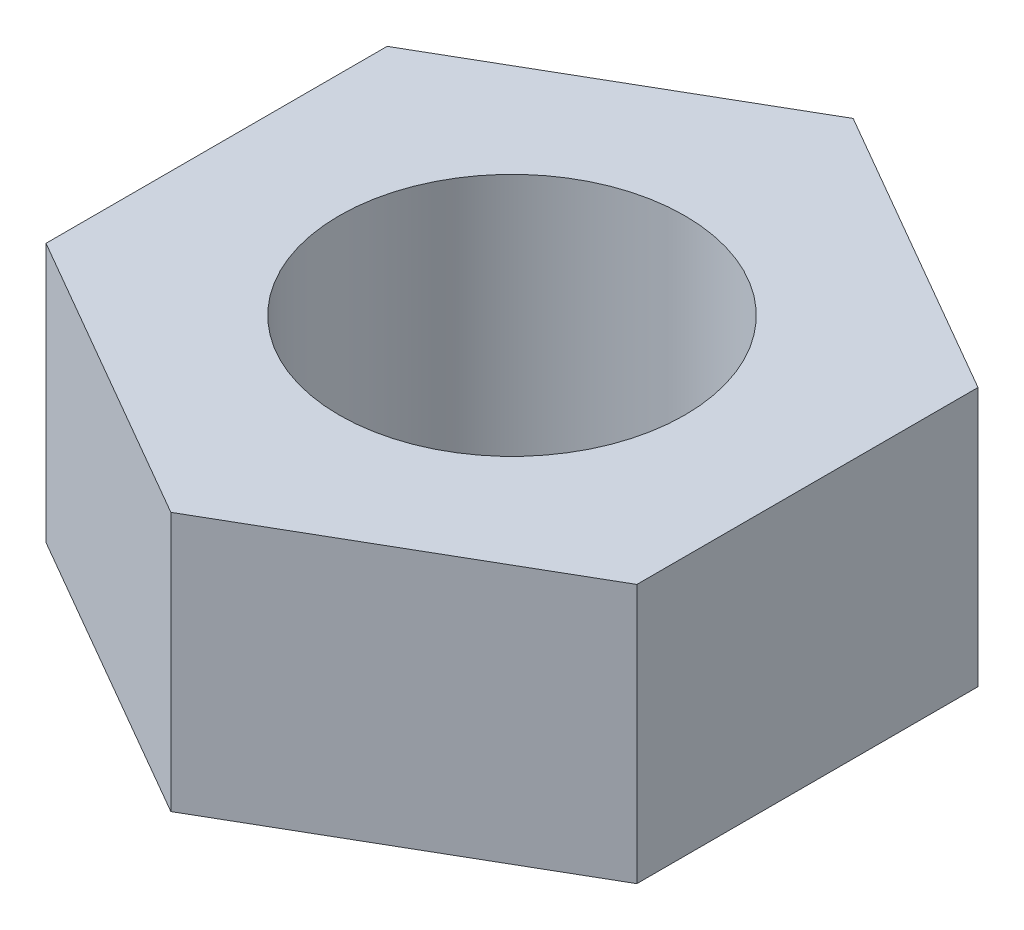
from build123d import *

# Parameters (mm, degrees)
SKETCH1_R           = 2
BOSS_EXTRUDE1_DEPTH = 3


with BuildPart() as part:
    # Sketch1 → Boss-Extrude1 (new body)
    with BuildSketch(Plane(origin=(0, 0, 0), x_dir=(1, 0, 0), z_dir=(0, 1, 0))):
        Polygon((0, -3.949075841), (3.42, -1.974537921), (3.42, 1.974537921), (0, 3.949075841), (-3.42, 1.974537921), (-3.42, -1.974537921), align=None)
        with Locations(Location((0, 0, 0), (0, 0, 270))):
            Circle(SKETCH1_R, mode=Mode.SUBTRACT)
    extrude(amount=BOSS_EXTRUDE1_DEPTH)


solid = part.part
